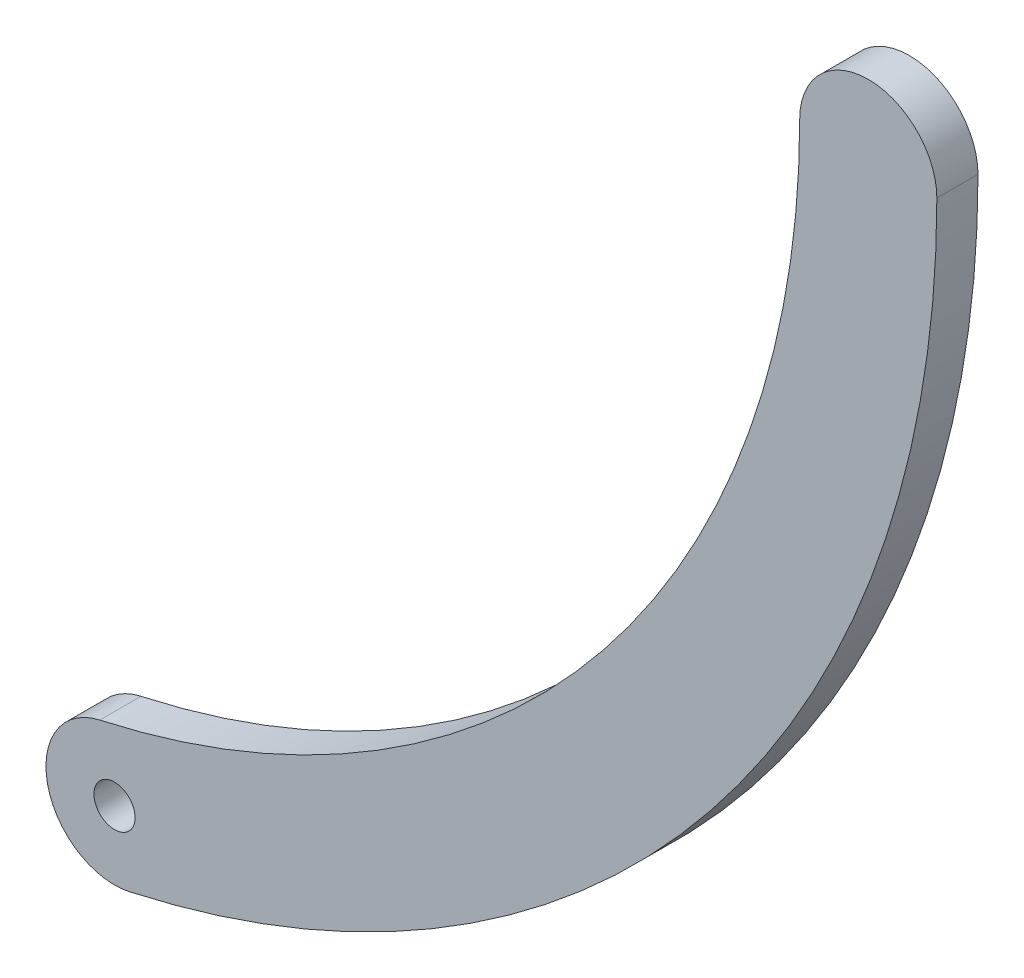
from build123d import *

# Parameters (mm, degrees)
CROQUIS1_R              = 1.5
SALIENTE_EXTRUIR1_DEPTH = 3


with BuildPart() as part:
    # Croquis1 → Saliente-Extruir1 (new body)
    with BuildSketch(Plane.XY):
        with BuildLine():
            ThreePointArc((13.959461248, 4.732049888), (50.657501819, 27.486798441), (65, 68.215381886))
            ThreePointArc((65, 68.215381886), (70, 73.215381886), (75, 68.215381886))
            ThreePointArc((75, 68.215381886), (58.450963638, 21.220862527), (16.107070671, -5.034616574))
            ThreePointArc((16.107070671, -5.034616574), (10.149932729, -1.225088055), (13.959461248, 4.732049888))
        make_face()
        with Locations((15.03326596, -0.151283343)):
            Circle(CROQUIS1_R, mode=Mode.SUBTRACT)
    extrude(amount=SALIENTE_EXTRUIR1_DEPTH)


solid = part.part
